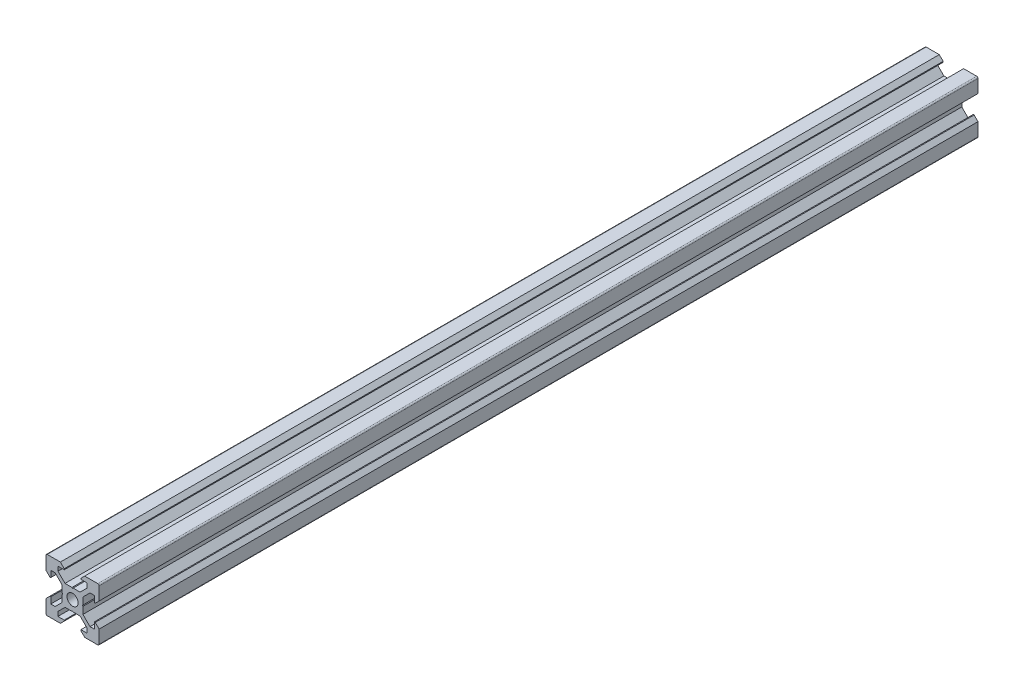
from build123d import *

# Parameters (mm, degrees)
SKETCH1_R           = 2.1
BOSS_EXTRUDE1_DEPTH = 331


with BuildPart() as part:
    # Sketch1 → Boss-Extrude1 (new body)
    with BuildSketch(Plane.XY):
        with BuildLine():
            Line((4.58, -10), (9.5, -10))
            ThreePointArc((9.5, -10), (9.853553391, -9.853553391), (10, -9.5))
            Line((10, -9.5), (10, -4.58))
            Line((10, -4.58), (8.545, -3.125))
            Line((8.545, -3.125), (8.2, -3.125))
            Line((8.2, -3.125), (8.2, -5.5))
            Line((8.2, -5.5), (6.560660172, -5.5))
            Line((6.560660172, -5.5), (3.9, -2.839339828))
            Line((3.9, -2.839339828), (3.9, -0.21))
            Line((3.9, -0.21), (3.69, 0))
            Line((3.69, 0), (3.9, 0.21))
            Line((3.9, 0.21), (3.9, 2.839339828))
            Line((3.9, 2.839339828), (6.560660172, 5.5))
            Line((6.560660172, 5.5), (8.2, 5.5))
            Line((8.2, 5.5), (8.2, 3.125))
            Line((8.2, 3.125), (8.545, 3.125))
            Line((8.545, 3.125), (10, 4.58))
            Line((10, 4.58), (10, 9.5))
            ThreePointArc((10, 9.5), (9.853553391, 9.853553391), (9.5, 10))
            Line((9.5, 10), (4.58, 10))
            Line((4.58, 10), (3.125, 8.545))
            Line((3.125, 8.545), (3.125, 8.2))
            Line((3.125, 8.2), (5.5, 8.2))
            Line((5.5, 8.2), (5.5, 6.560660172))
            Line((5.5, 6.560660172), (2.839339828, 3.9))
            Line((2.839339828, 3.9), (0.21, 3.9))
            Line((0.21, 3.9), (0, 3.69))
            Line((0, 3.69), (-0.21, 3.9))
            Line((-0.21, 3.9), (-2.839339828, 3.9))
            Line((-2.839339828, 3.9), (-5.5, 6.560660172))
            Line((-5.5, 6.560660172), (-5.5, 8.2))
            Line((-5.5, 8.2), (-3.125, 8.2))
            Line((-3.125, 8.2), (-3.125, 8.545))
            Line((-3.125, 8.545), (-4.58, 10))
            Line((-4.58, 10), (-9.5, 10))
            ThreePointArc((-9.5, 10), (-9.853553391, 9.853553391), (-10, 9.5))
            Line((-10, 9.5), (-10, 4.58))
            Line((-10, 4.58), (-8.545, 3.125))
            Line((-8.545, 3.125), (-8.2, 3.125))
            Line((-8.2, 3.125), (-8.2, 5.5))
            Line((-8.2, 5.5), (-6.560660172, 5.5))
            Line((-6.560660172, 5.5), (-3.9, 2.839339828))
            Line((-3.9, 2.839339828), (-3.9, 0.21))
            Line((-3.9, 0.21), (-3.69, 0))
            Line((-3.69, 0), (-3.9, -0.21))
            Line((-3.9, -0.21), (-3.9, -2.839339828))
            Line((-3.9, -2.839339828), (-6.560660172, -5.5))
            Line((-6.560660172, -5.5), (-8.2, -5.5))
            Line((-8.2, -5.5), (-8.2, -3.125))
            Line((-8.2, -3.125), (-8.545, -3.125))
            Line((-8.545, -3.125), (-10, -4.58))
            Line((-10, -4.58), (-10, -9.5))
            ThreePointArc((-10, -9.5), (-9.853553391, -9.853553391), (-9.5, -10))
            Line((-9.5, -10), (-4.58, -10))
            Line((-4.58, -10), (-3.125, -8.545))
            Line((-3.125, -8.545), (-3.125, -8.2))
            Line((-3.125, -8.2), (-5.5, -8.2))
            Line((-5.5, -8.2), (-5.5, -6.560660172))
            Line((-5.5, -6.560660172), (-2.839339828, -3.9))
            Line((-2.839339828, -3.9), (-0.21, -3.9))
            Line((-0.21, -3.9), (0, -3.69))
            Line((0, -3.69), (0.21, -3.9))
            Line((0.21, -3.9), (2.839339828, -3.9))
            Line((2.839339828, -3.9), (5.5, -6.560660172))
            Line((5.5, -6.560660172), (5.5, -8.2))
            Line((5.5, -8.2), (3.125, -8.2))
            Line((3.125, -8.2), (3.125, -8.545))
            Line((3.125, -8.545), (4.58, -10))
        make_face()
        Circle(SKETCH1_R, mode=Mode.SUBTRACT)
    extrude(amount=BOSS_EXTRUDE1_DEPTH)


solid = part.part
